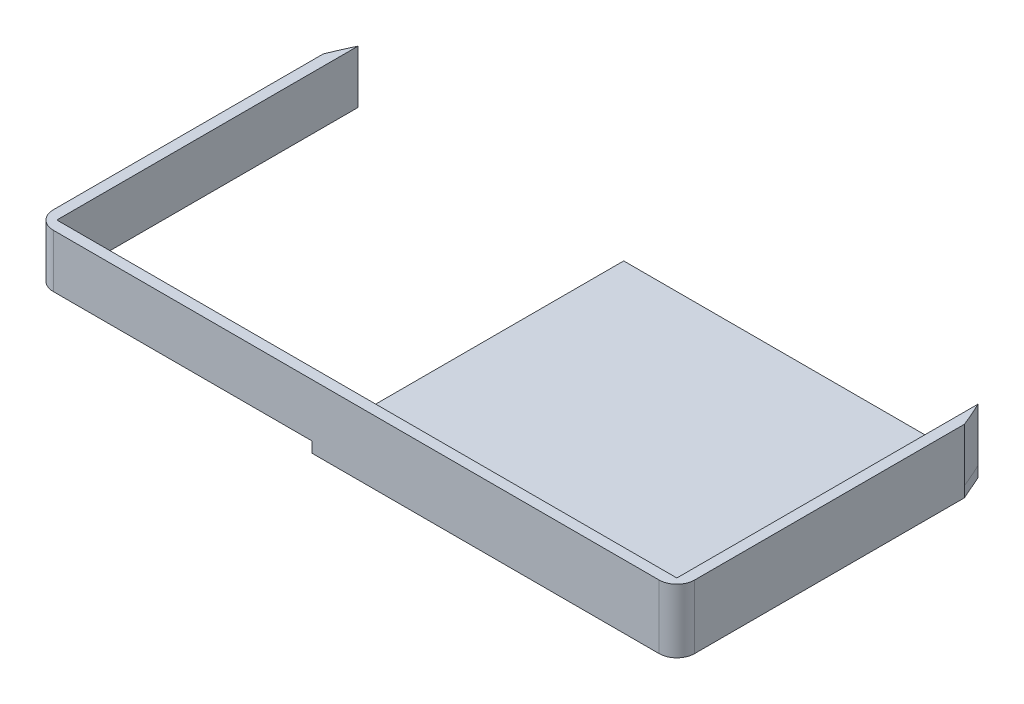
from build123d import *

# Parameters (mm, degrees)
BOSS_EXTRUDE2_DEPTH = 15
BOSS_EXTRUDE3_START = -3
BOSS_EXTRUDE3_DEPTH = 3


with BuildPart() as part:
    # Sketch1 → Boss-Extrude2 (new body)
    with BuildSketch(Plane(origin=(0, 0, 0), x_dir=(1, 0, 0), z_dir=(0, 1, 0))):
        with BuildLine():
            ThreePointArc((-85.5, -45.5), (-89.035533906, -44.035533906), (-90.5, -40.5))
            Line((-90.5, -40.5), (-90.5, 35.668613654))
            ThreePointArc((-90.5, 35.668613654), (-89.065520601, 39.113080167), (-87.5, 42.5))
            Line((-87.5, 42.5), (-87.5, -42.5))
            Line((-87.5, -42.5), (87.5, -42.5))
            Line((87.5, -42.5), (87.5, 42.5))
            ThreePointArc((87.5, 42.5), (89.065520601, 39.113080167), (90.5, 35.668613654))
            Line((90.5, 35.668613654), (90.5, -40.5))
            ThreePointArc((90.5, -40.5), (89.035533906, -44.035533906), (85.5, -45.5))
            Line((85.5, -45.5), (-85.5, -45.5))
        make_face()
    extrude(amount=BOSS_EXTRUDE2_DEPTH)

    # Sketch3 → Boss-Extrude3 (add)
    with BuildSketch(Plane(origin=(0, 0, 0), x_dir=(1, 0, 0), z_dir=(0, 1, 0)).offset(BOSS_EXTRUDE3_START)):
        with BuildLine():
            Line((87.5, 42.5), (-12.5, 42.5))
            Line((-12.5, 42.5), (-12.5, -45.5))
            Line((-12.5, -45.5), (85.5, -45.5))
            ThreePointArc((85.5, -45.5), (89.035533906, -44.035533906), (90.5, -40.5))
            Line((90.5, -40.5), (90.5, 35.668613654))
            Line((90.5, 35.668613654), (87.5, 42.5))
        make_face()
    extrude(amount=BOSS_EXTRUDE3_DEPTH)


solid = part.part
